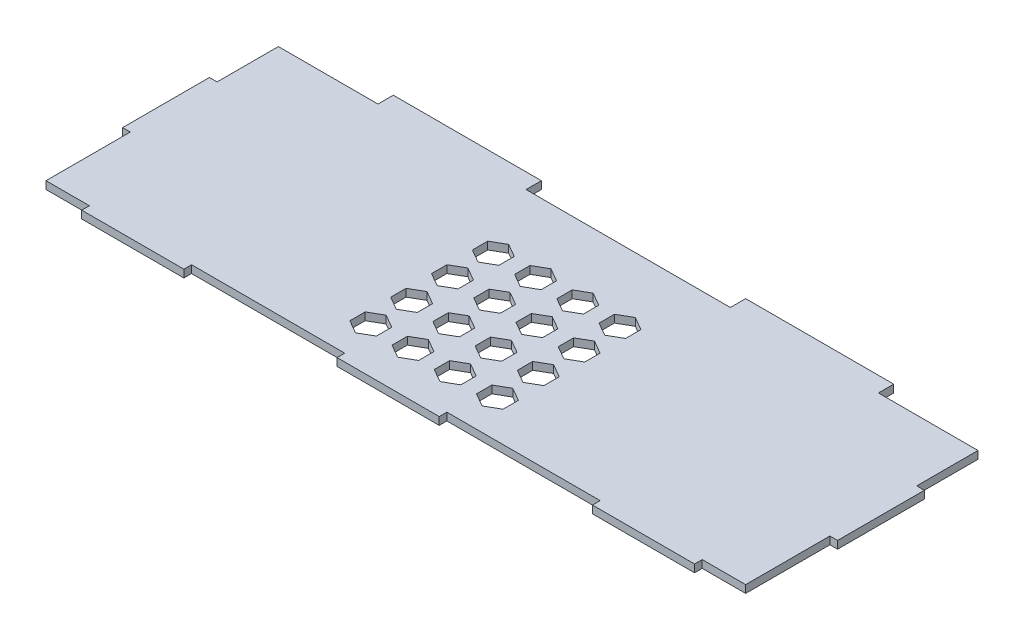
from build123d import *

# Parameters (mm, degrees)
BOSS_EXTRUDE1_DEPTH = 1.5
CUT_EXTRUDE1_DEPTH  = 75.863208587
SKETCH6_W           = 1.5
SKETCH6_H           = 12
SKETCH6_H_2         = 16.5
SKETCH6_H_3         = 1.5
SKETCH6_W_2         = 8.5
SKETCH6_W_3         = 30
CUT_EXTRUDE2_DEPTH  = 75.863208587


with BuildPart() as part:
    # Sketch2 → Boss-Extrude1 (new body)
    with BuildSketch(Plane(origin=(0, 0, 0), x_dir=(1, 0, 0), z_dir=(0, 1, 0))):
        Polygon((-70, 23.5), (-49, 23.5), (-49, 26.5), (-20, 26.5), (-20, 23.5), (20, 23.5), (20, 26.5), (49, 26.5), (49, 23.5), (70, 23.5), (70, -23.5), (-70, -23.5), align=None)
    extrude(amount=BOSS_EXTRUDE1_DEPTH)

    # Sketch5 → Cut-Extrude1 (cut, through all)
    with BuildSketch(Plane(origin=(0, 1.5, 0), x_dir=(1, 0, 0), z_dir=(0, 1, 0))):
        Polygon((-4.133974596, -11.5), (-6.732050808, -13), (-6.732050808, -16), (-4.133974596, -17.5), (-1.535898385, -16), (-1.535898385, -13), align=None)
        Polygon((-12.401923789, -11.5), (-15, -13), (-15, -16), (-12.401923789, -17.5), (-9.803847577, -16), (-9.803847577, -13), align=None)
        Polygon((4.133974596, -11.5), (1.535898385, -13), (1.535898385, -16), (4.133974596, -17.5), (6.732050808, -16), (6.732050808, -13), align=None)
        Polygon((12.401923789, -11.5), (9.803847577, -13), (9.803847577, -16), (12.401923789, -17.5), (15, -16), (15, -13), align=None)
        Polygon((-4.133974596, -3.5), (-6.732050808, -5), (-6.732050808, -8), (-4.133974596, -9.5), (-1.535898385, -8), (-1.535898385, -5), align=None)
        Polygon((4.133974596, -3.5), (1.535898385, -5), (1.535898385, -8), (4.133974596, -9.5), (6.732050808, -8), (6.732050808, -5), align=None)
        Polygon((12.401923789, -3.5), (9.803847577, -5), (9.803847577, -8), (12.401923789, -9.5), (15, -8), (15, -5), align=None)
        Polygon((-4.133974596, 4.5), (-6.732050808, 3), (-6.732050808, 0), (-4.133974596, -1.5), (-1.535898385, 0), (-1.535898385, 3), align=None)
        Polygon((4.133974596, 4.5), (1.535898385, 3), (1.535898385, 0), (4.133974596, -1.5), (6.732050808, 0), (6.732050808, 3), align=None)
        Polygon((12.401923789, 4.5), (9.803847577, 3), (9.803847577, 0), (12.401923789, -1.5), (15, 0), (15, 3), align=None)
        Polygon((-4.133974596, 12.5), (-6.732050808, 11), (-6.732050808, 8), (-4.133974596, 6.5), (-1.535898385, 8), (-1.535898385, 11), align=None)
        Polygon((4.133974596, 12.5), (1.535898385, 11), (1.535898385, 8), (4.133974596, 6.5), (6.732050808, 8), (6.732050808, 11), align=None)
        Polygon((12.401923789, 12.5), (9.803847577, 11), (9.803847577, 8), (12.401923789, 6.5), (15, 8), (15, 11), align=None)
        Polygon((-12.401923789, -3.5), (-15, -5), (-15, -8), (-12.401923789, -9.5), (-9.803847577, -8), (-9.803847577, -5), align=None)
        Polygon((-12.401923789, 4.5), (-15, 3), (-15, 0), (-12.401923789, -1.5), (-9.803847577, 0), (-9.803847577, 3), align=None)
        Polygon((-12.401923789, 12.5), (-15, 11), (-15, 8), (-12.401923789, 6.5), (-9.803847577, 8), (-9.803847577, 11), align=None)
    extrude(amount=-CUT_EXTRUDE1_DEPTH, mode=Mode.SUBTRACT)

    # Sketch6 → Cut-Extrude2 (cut, through all)
    with BuildSketch(Plane(origin=(0, 1.5, 0), x_dir=(1, 0, 0), z_dir=(0, 1, 0))):
        with Locations((69.25, 17.5)):
            Rectangle(SKETCH6_W, SKETCH6_H)
        with Locations((69.25, -13.75)):
            Rectangle(SKETCH6_W, SKETCH6_H_2)
        with Locations((69.25, -22.75)):
            Rectangle(SKETCH6_W, SKETCH6_H_3)
        with Locations((64.25, -22.75)):
            Rectangle(SKETCH6_W_2, SKETCH6_H_3)
        with Locations((25, -22.75)):
            Rectangle(SKETCH6_W_3, SKETCH6_H_3)
        with Locations((-25, -22.75)):
            Rectangle(SKETCH6_W_3, SKETCH6_H_3)
        with Locations((-69.25, 17.5)):
            Rectangle(SKETCH6_W, SKETCH6_H)
        with Locations((-69.25, -13.75)):
            Rectangle(SKETCH6_W, SKETCH6_H_2)
        with Locations((-69.25, -22.75)):
            Rectangle(SKETCH6_W, SKETCH6_H_3)
        with Locations((-64.25, -22.75)):
            Rectangle(SKETCH6_W_2, SKETCH6_H_3)
    extrude(amount=-CUT_EXTRUDE2_DEPTH, mode=Mode.SUBTRACT)


solid = part.part
